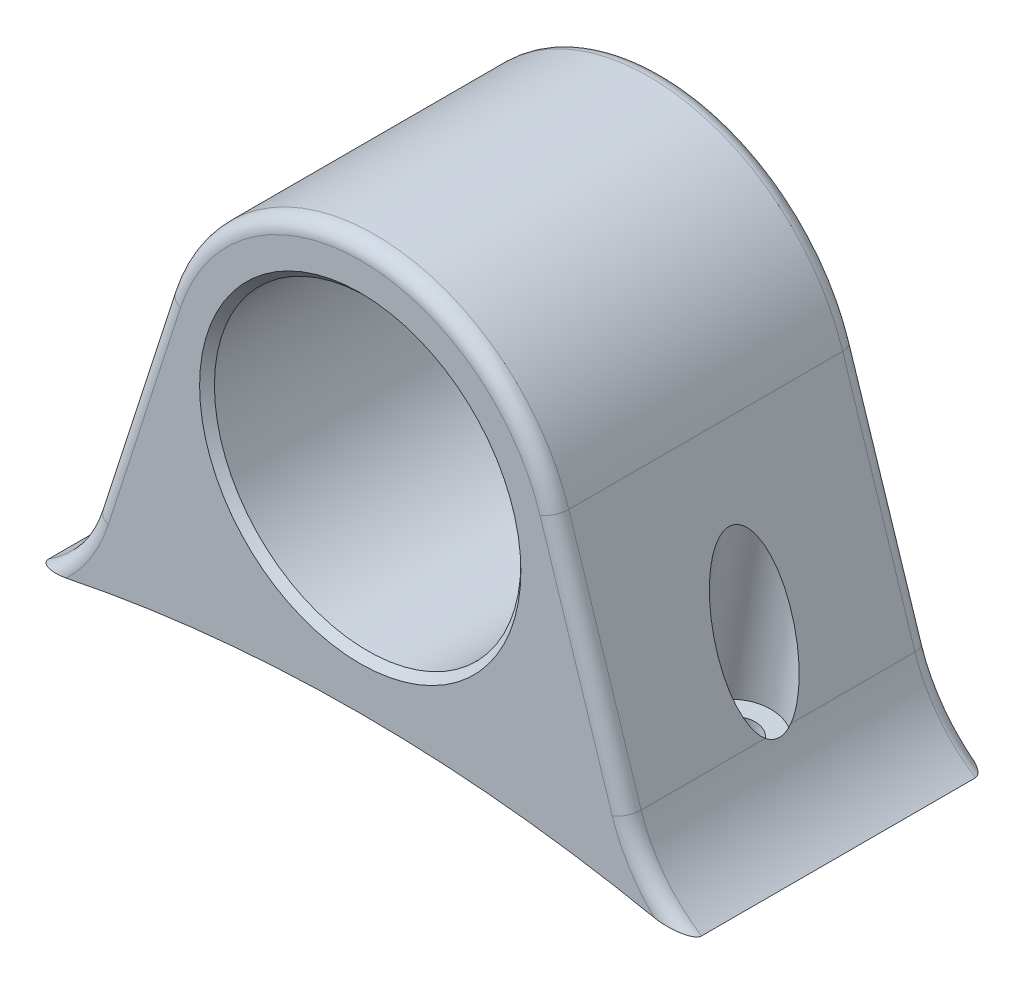
from build123d import *

# Parameters (mm, degrees)
SKETCH1_R           = 26.289
BOSS_EXTRUDE1_DEPTH = 48.26
FILLET1_R           = 2.54
CHAMFER1_SIZE       = 1.27
SKETCH2_R           = 6.35
SKETCH2_R_2         = 2.54
BOSS_EXTRUDE2_DEPTH = 3.81
FILLET2_R           = 2.54
SKETCH4_R           = 3.175
CUT_EXTRUDE1_DEPTH  = 110.759820078
CUT_EXTRUDE2_START  = -6.35
SKETCH5_R           = 6.35
CUT_EXTRUDE2_DEPTH  = 104.409820078


with BuildPart() as part:
    # Sketch1 → Boss-Extrude1 (new body)
    with BuildSketch(Plane.XY):
        with BuildLine():
            Line((-45.642801894, 83.373274477), (-33.240070063, 121.841966324))
            ThreePointArc((-33.240070063, 121.841966324), (0, 146.05), (33.240070063, 121.841966324))
            Line((33.240070063, 121.841966324), (45.642801894, 83.373274477))
            ThreePointArc((45.642801894, 83.373274477), (49.65717276, 75.716693762), (56.007, 69.85))
            ThreePointArc((56.007, 69.85), (0, 76.2), (-56.007, 69.85))
            ThreePointArc((-56.007, 69.85), (-49.65717276, 75.716693762), (-45.642801894, 83.373274477))
        make_face()
        with Locations((0, 111.125)):
            Circle(SKETCH1_R, mode=Mode.SUBTRACT)
    extrude(amount=-BOSS_EXTRUDE1_DEPTH)

    # Fillet1
    fillet1_edges = [part.edges().sort_by_distance(p)[0] for p in [
        (-49.65717276, 75.716693762, 0),
        (-39.441435979, 102.6076204, 0),
        (0, 146.05, 0),
        (39.441435979, 102.6076204, 0),
        (49.65717276, 75.716693762, 0),
    ]]
    fillet(fillet1_edges, radius=FILLET1_R)

    # Chamfer1
    chamfer1_edges = [part.edges().sort_by_distance(p)[0] for p in [
        (-26.289, 111.125, 0),
    ]]
    chamfer(chamfer1_edges, length=CHAMFER1_SIZE)

    # Sketch2 → Boss-Extrude2 (add)
    with BuildSketch(Plane(origin=(0, 0, -48.26), x_dir=(-1, 0, 0), z_dir=(0, 0, -1))):
        with BuildLine():
            Line((45.642801894, 83.373274477), (33.240070063, 121.841966324))
            ThreePointArc((33.240070063, 121.841966324), (0, 146.05), (-33.240070063, 121.841966324))
            Line((-33.240070063, 121.841966324), (-45.642801894, 83.373274477))
            ThreePointArc((-45.642801894, 83.373274477), (-49.65717276, 75.716693762), (-56.007, 69.85))
            ThreePointArc((-56.007, 69.85), (0, 76.2), (56.007, 69.85))
            ThreePointArc((56.007, 69.85), (49.65717276, 75.716693762), (45.642801894, 83.373274477))
        make_face()
        with Locations(Location((0, 97.917, 0), (0, 0, 180))):
            Circle(SKETCH2_R, mode=Mode.SUBTRACT)
        with Locations(Location((0, 124.333, 0), (0, 0, 180))):
            Circle(SKETCH2_R_2, mode=Mode.SUBTRACT)
        with BuildLine():
            Line((-21.336, 113.792), (-16.002, 113.792))
            ThreePointArc((-16.002, 113.792), (-13.335, 111.125), (-16.002, 108.458))
            Line((-16.002, 108.458), (-21.336, 108.458))
            ThreePointArc((-21.336, 108.458), (-24.003, 111.125), (-21.336, 113.792))
        make_face(mode=Mode.SUBTRACT)
        with BuildLine():
            Line((21.336, 113.792), (16.002, 113.792))
            ThreePointArc((16.002, 113.792), (13.335, 111.125), (16.002, 108.458))
            Line((16.002, 108.458), (21.336, 108.458))
            ThreePointArc((21.336, 108.458), (24.003, 111.125), (21.336, 113.792))
        make_face(mode=Mode.SUBTRACT)
    extrude(amount=BOSS_EXTRUDE2_DEPTH)

    # Fillet2
    fillet2_edges = [part.edges().sort_by_distance(p)[0] for p in [
        (-49.65717276, 75.716693762, -52.07),
        (-39.441435979, 102.6076204, -52.07),
        (0, 146.05, -52.07),
        (39.441435979, 102.6076204, -52.07),
        (49.65717276, 75.716693762, -52.07),
    ]]
    fillet(fillet2_edges, radius=FILLET2_R)

    # Sketch4 → Cut-Extrude1 (cut, symmetric)
    with BuildSketch(Plane(origin=(11.899806241, 77.314282605, 0), x_dir=(-0.9883615104677608, 0.15212338618991694, 0), z_dir=(-0.15212338618991694, -0.9883615104677608, 0))):
        with Locations(Location((-26.464277226, 26.035, 0), (0, 0, 180))):
            Circle(SKETCH4_R)
    cut_extrude1 = extrude(amount=CUT_EXTRUDE1_DEPTH, both=True, mode=Mode.SUBTRACT)

    # Sketch5 → Cut-Extrude2 (cut, through all)
    with BuildSketch(Plane(origin=(11.899806241, 77.314282605, 0), x_dir=(-0.9883615104677608, 0.15212338618991694, 0), z_dir=(-0.15212338618991694, -0.9883615104677608, 0)).offset(CUT_EXTRUDE2_START)):
        with Locations(Location((-26.464277226, 26.035, 0), (0, 0, 180))):
            Circle(SKETCH5_R)
    cut_extrude2 = extrude(amount=-CUT_EXTRUDE2_DEPTH, mode=Mode.SUBTRACT)

    # Mirror1: Cut-Extrude1, Cut-Extrude2 across plane
    add(cut_extrude1.mirror(Plane(origin=(0, 0, 0), x_dir=(0, 0, 1), z_dir=(1, 0, 0))), mode=Mode.SUBTRACT)
    add(cut_extrude2.mirror(Plane(origin=(0, 0, 0), x_dir=(0, 0, 1), z_dir=(1, 0, 0))), mode=Mode.SUBTRACT)


solid = part.part
